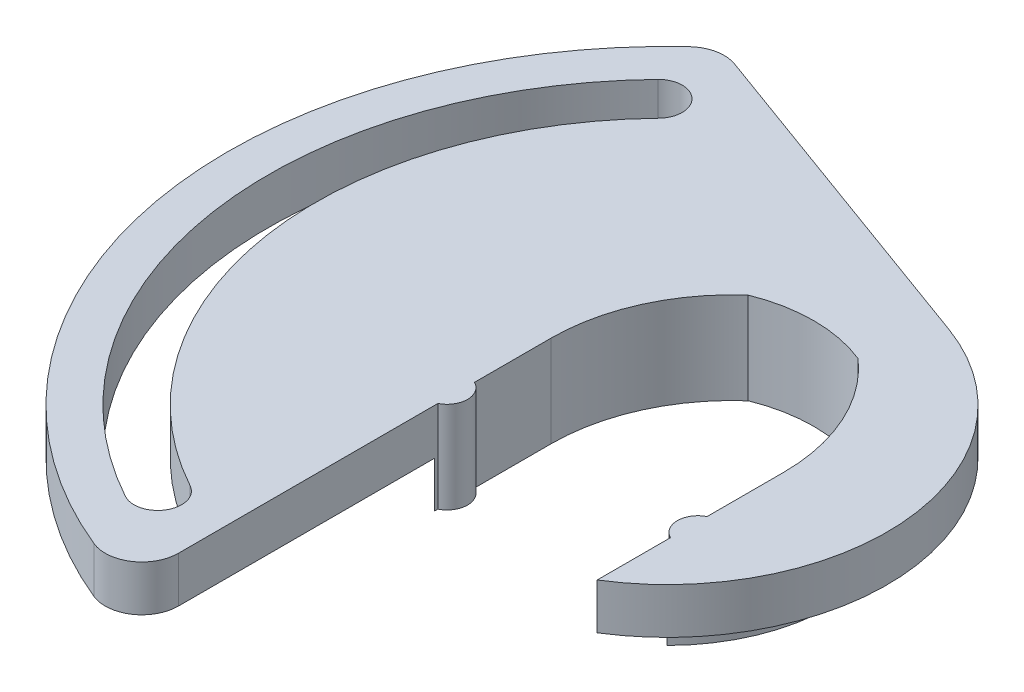
from build123d import *

# Parameters (mm, degrees)
BOSS_EXTRUDE1_DEPTH = 2.5
BOSS_EXTRUDE2_DEPTH = 2.5
FILLET1_R           = 2
CUT_EXTRUDE1_DEPTH  = 34.176689588
BOSS_EXTRUDE3_DEPTH = 5


with BuildPart() as part:
    # Sketch1 → Boss-Extrude1 (new body)
    with BuildSketch(Plane(origin=(0, 0, 0), x_dir=(1, 0, 0), z_dir=(0, 1, 0))):
        with BuildLine():
            Line((-6.35, 0), (-6.35, -6.377891501))
            ThreePointArc((-6.35, -6.377891501), (0, 9), (6.35, -6.377891501))
            Line((6.35, -6.377891501), (6.35, 0))
            ThreePointArc((6.35, 0), (5.473649667, 4.068860406), (3, 7.416198487))
            ThreePointArc((3, 7.416198487), (0, 8), (-3, 7.416198487))
            ThreePointArc((-3, 7.416198487), (-5.473649667, 4.068860406), (-6.35, 0))
        make_face()
    extrude(amount=BOSS_EXTRUDE1_DEPTH)



with BuildPart() as body_2:
    # Sketch2 → Boss-Extrude2 (new body)
    with BuildSketch(Plane(origin=(0, 2.5, 0), x_dir=(1, 0, 0), z_dir=(0, 1, 0))):
        with BuildLine():
            Line((4.10424172, 11.276311449), (-15.426902632, 18.385066635))
            ThreePointArc((-15.426902632, 18.385066635), (-23.446511758, -5.124557191), (-6.35, -23.144707818))
            Line((-6.35, -23.144707818), (-6.35, -6.377891501))
            Line((-6.35, -6.377891501), (-6.35, 0))
            ThreePointArc((-6.35, 0), (-5.473649667, 4.068860406), (-3, 7.416198487))
            ThreePointArc((-3, 7.416198487), (0, 8), (3, 7.416198487))
            ThreePointArc((3, 7.416198487), (5.473649667, 4.068860406), (6.35, 0))
            Line((6.35, 0), (6.35, -10.182214887))
            ThreePointArc((6.35, -10.182214887), (11.934817997, 1.249047391), (4.10424172, 11.276311449))
        make_face()
    extrude(amount=BOSS_EXTRUDE2_DEPTH)

    # Fillet1
    fillet1_edges = [body_2.edges().sort_by_distance(p)[0] for p in [
        (-6.35, 3.75, 23.144707818),
        (-15.426902632, 3.75, -18.385066635),
    ]]
    fillet(fillet1_edges, radius=FILLET1_R)

    # Sketch3 → Cut-Extrude1 (cut, through all)
    with BuildSketch(Plane(origin=(0, 5, 0), x_dir=(1, 0, 0), z_dir=(0, 1, 0))):
        with BuildLine():
            ThreePointArc((-9.23213936, -16.834714219), (-8.717381687, -18.59965743), (-10.482324898, -19.114415103))
            ThreePointArc((-10.482324898, -19.114415103), (-21.553925967, -3.266232604), (-15.674771193, 15.150628635))
            ThreePointArc((-15.674771193, 15.150628635), (-13.836559277, 15.181884843), (-13.805303069, 13.343672927))
            ThreePointArc((-13.805303069, 13.343672927), (-18.983274246, -2.876681926), (-9.23213936, -16.834714219))
        make_face()
    extrude(amount=-CUT_EXTRUDE1_DEPTH, mode=Mode.SUBTRACT)


with BuildPart() as part_1:
    add(part.part)

    add(body_2.part)  # Boss-Extrude3 merges body 2
    # Sketch6 → Boss-Extrude3 (add)
    with BuildSketch(Plane(origin=(0, 5, 0), x_dir=(1, 0, 0), z_dir=(0, 1, 0))):
        with BuildLine():
            Line((6.35, -6.182214887), (6.35, -4.182214887))
            ThreePointArc((6.35, -4.182214887), (5.731966011, -5.182214887), (6.35, -6.182214887))
        make_face()
    boss_extrude3 = extrude(amount=-BOSS_EXTRUDE3_DEPTH)

    # Mirror1: Boss-Extrude3 across plane
    add(boss_extrude3.mirror(Plane(origin=(0, 0, 0), x_dir=(0, 0, 1), z_dir=(1, 0, 0))))


solid = part_1.part
